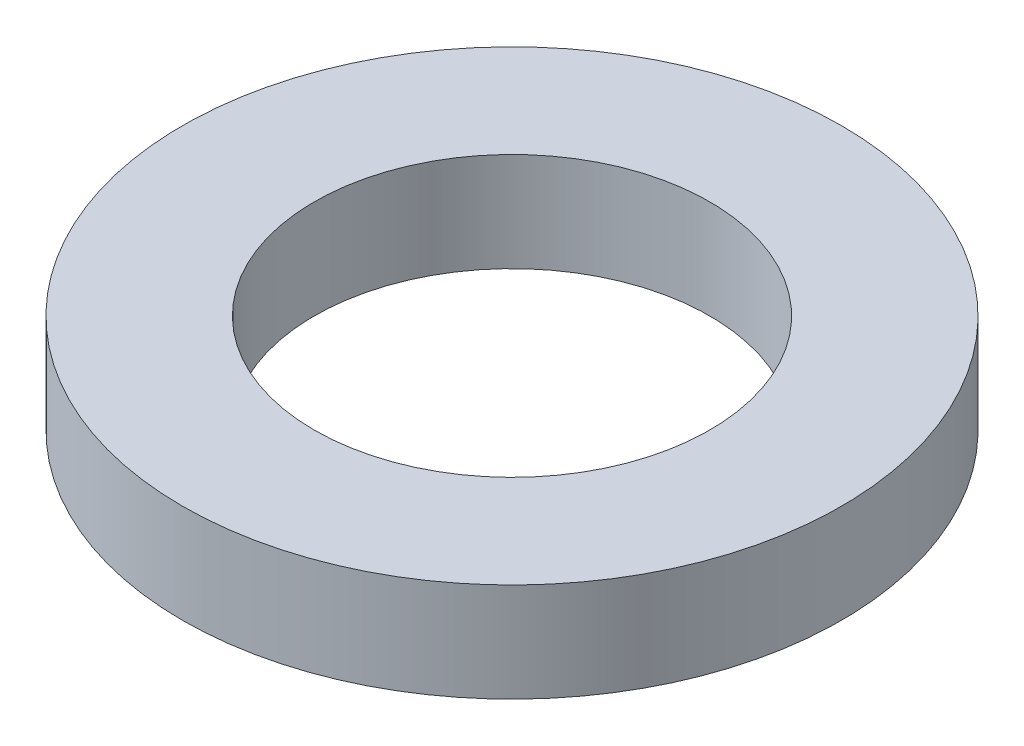
from build123d import *

# Parameters (mm, degrees)
SKETCH1_R           = 10
SKETCH1_R_2         = 6
BOSS_EXTRUDE1_DEPTH = 3


with BuildPart() as part:
    # Sketch1 → Boss-Extrude1 (new body)
    with BuildSketch(Plane(origin=(0, 0, 0), x_dir=(1, 0, 0), z_dir=(0, 1, 0))):
        with Locations(Location((0, 0, 0), (0, 0, 270))):
            Circle(SKETCH1_R)
        with Locations(Location((0, 0, 0), (0, 0, 270))):
            Circle(SKETCH1_R_2, mode=Mode.SUBTRACT)
    extrude(amount=BOSS_EXTRUDE1_DEPTH)


solid = part.part
